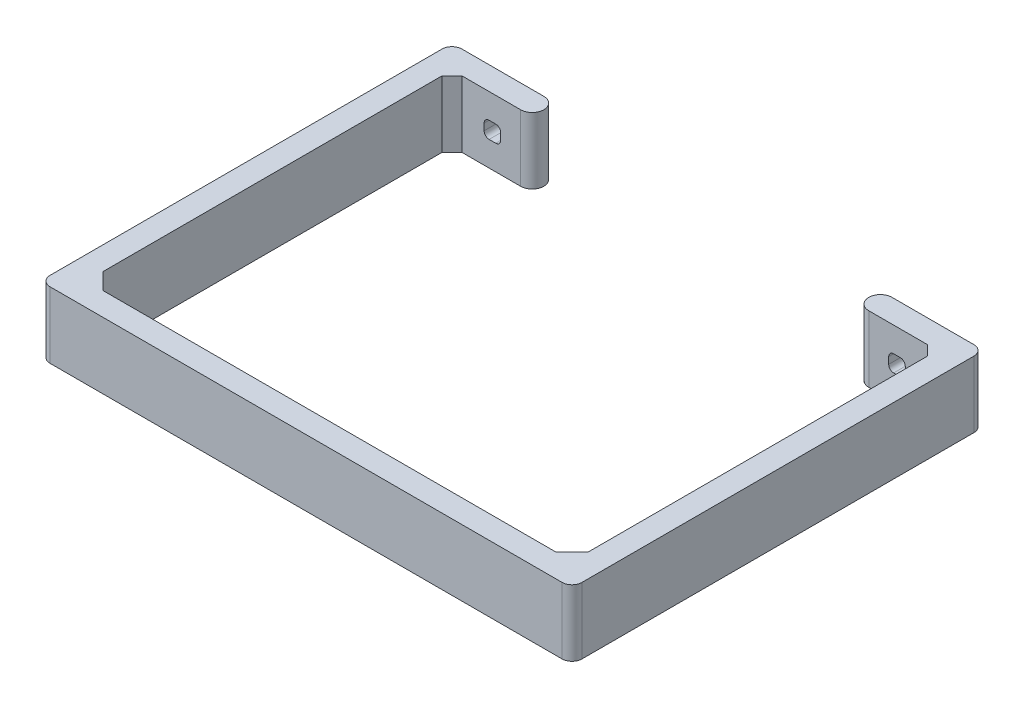
from build123d import *

# Parameters (mm, degrees)
ESBO_O1_W                    = 160.4
ESBO_O1_H                    = 124.2
ESBO_O1_W_2                  = 146.4
ESBO_O1_H_2                  = 110.2
PAREDES_DEPTH                = 20
CHANFROS_INTERNO_FRENTE_SIZE = 5
FILETE1_R                    = 3
FILETE2_R                    = 3
ESBO_O2_W                    = 98
ESBO_O2_H                    = 30
CORTE_EXTRUS_O1_DEPTH        = 20
FILETE3_RADIUS               = 3.5
FILETE3_LENGTH               = 20
FILETE4_RADIUS               = 3.5
FILETE4_LENGTH               = 20
FILETE5_R                    = 3
FILETE6_R                    = 3
CHANFRO2_SIZE                = 3


with BuildPart() as part:
    # Esboço1 → Paredes (new body)
    with BuildSketch(Plane(origin=(0, 0, 0), x_dir=(1, 0, 0), z_dir=(0, 1, 0))):
        Rectangle(ESBO_O1_W, ESBO_O1_H)
        Rectangle(ESBO_O1_W_2, ESBO_O1_H_2, mode=Mode.SUBTRACT)
    extrude(amount=PAREDES_DEPTH)

    # Chanfros Interno Frente
    chanfros_interno_frente_edges = [part.edges().sort_by_distance(p)[0] for p in [
        (73.2, 10, 55.1),
        (-73.2, 10, 55.1),
    ]]
    chamfer(chanfros_interno_frente_edges, length=CHANFROS_INTERNO_FRENTE_SIZE)

    # Filete1
    filete1_edges = [part.edges().sort_by_distance(p)[0] for p in [
        (-80.2, 10, 62.1),
    ]]
    fillet(filete1_edges, radius=FILETE1_R)

    # Filete2
    filete2_edges = [part.edges().sort_by_distance(p)[0] for p in [
        (80.2, 10, 62.1),
    ]]
    fillet(filete2_edges, radius=FILETE2_R)

    # Esboço2 → Corte-extrusão1 (cut)
    with BuildSketch(Plane(origin=(0, 0, -62.1), x_dir=(-1, 0, 0), z_dir=(0, 0, -1))):
        with Locations((0, 10)):
            Rectangle(ESBO_O2_W, ESBO_O2_H)
        with BuildLine():
            Line((58.5, 11), (58.5, 9))
            ThreePointArc((58.5, 9), (58.939339828, 7.939339828), (60, 7.5))
            Line((60, 7.5), (62, 7.5))
            ThreePointArc((62, 7.5), (63.060660172, 7.939339828), (63.5, 9))
            Line((63.5, 9), (63.5, 11))
            ThreePointArc((63.5, 11), (63.060660172, 12.060660172), (62, 12.5))
            Line((62, 12.5), (60, 12.5))
            ThreePointArc((60, 12.5), (58.939339828, 12.060660172), (58.5, 11))
        make_face()
        with BuildLine():
            Line((-62, 12.5), (-60, 12.5))
            ThreePointArc((-60, 12.5), (-58.939339828, 12.060660172), (-58.5, 11))
            Line((-58.5, 11), (-58.5, 9))
            ThreePointArc((-58.5, 9), (-58.939339828, 7.939339828), (-60, 7.5))
            Line((-60, 7.5), (-62, 7.5))
            ThreePointArc((-62, 7.5), (-63.060660172, 7.939339828), (-63.5, 9))
            Line((-63.5, 9), (-63.5, 11))
            ThreePointArc((-63.5, 11), (-63.060660172, 12.060660172), (-62, 12.5))
        make_face()
    extrude(amount=-CORTE_EXTRUS_O1_DEPTH, mode=Mode.SUBTRACT)

    # Filete3: full round fillet: the end face becomes a half cylinder, R = half its width
    filete3_face = Plane((49, 10, -58.6), x_dir=(0, 1, 0), z_dir=(-1, 0, 0))  # on the end face: x along it, z out of the body
    filete3_slab = filete3_face.offset(-FILETE3_RADIUS / 2) * Box(FILETE3_LENGTH, 2 * FILETE3_RADIUS, FILETE3_RADIUS, mode=Mode.PRIVATE)  # the body's end, R deep
    filete3_round = Plane((52.5, 10, -58.6), x_dir=(-1, 0, 0), z_dir=(0, 1, 0)) * Cylinder(FILETE3_RADIUS, FILETE3_LENGTH, mode=Mode.PRIVATE)  # its axis R under the face
    add(filete3_slab - filete3_round, mode=Mode.SUBTRACT)

    # Filete4: full round fillet: the end face becomes a half cylinder, R = half its width
    filete4_face = Plane((-49, 10, -58.6), x_dir=(0, -1, 0), z_dir=(1, 0, 0))  # on the end face: x along it, z out of the body
    filete4_slab = filete4_face.offset(-FILETE4_RADIUS / 2) * Box(FILETE4_LENGTH, 2 * FILETE4_RADIUS, FILETE4_RADIUS, mode=Mode.PRIVATE)  # the body's end, R deep
    filete4_round = Plane((-52.5, 10, -58.6), x_dir=(1, 0, 0), z_dir=(0, -1, 0)) * Cylinder(FILETE4_RADIUS, FILETE4_LENGTH, mode=Mode.PRIVATE)  # its axis R under the face
    add(filete4_slab - filete4_round, mode=Mode.SUBTRACT)

    # Filete5
    filete5_edges = [part.edges().sort_by_distance(p)[0] for p in [
        (-80.2, 10, -62.1),
    ]]
    fillet(filete5_edges, radius=FILETE5_R)

    # Filete6
    filete6_edges = [part.edges().sort_by_distance(p)[0] for p in [
        (80.2, 10, -62.1),
    ]]
    fillet(filete6_edges, radius=FILETE6_R)

    # Chanfro2
    chanfro2_edges = [part.edges().sort_by_distance(p)[0] for p in [
        (73.2, 10, -55.1),
        (-73.2, 10, -55.1),
    ]]
    chamfer(chanfro2_edges, length=CHANFRO2_SIZE)


solid = part.part
